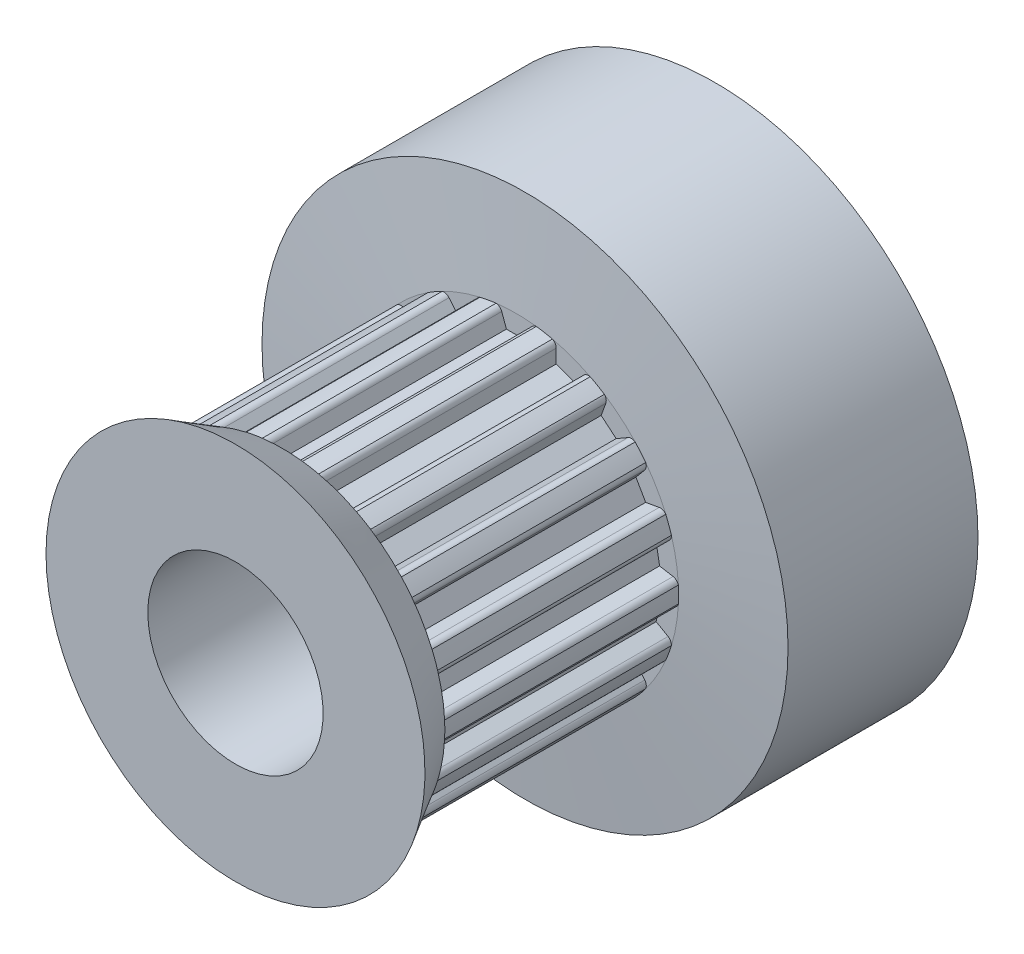
from build123d import *

# Parameters (mm, degrees)
CUT_EXTRUDE1_DEPTH      = 4
CUT_EXTRUDE1_DEPTH_BACK = 4
SKETCH9_R               = 1.5
CUT_EXTRUDE2_DEPTH      = 17.693560834
SKETCH9_3_R             = 1.5
CUT_EXTRUDE3_DEPTH      = 6


with BuildPart() as part:
    # Sketch8 → Revolve1 (revolve)
    with BuildSketch(Plane(origin=(0, 0, 0), x_dir=(0, 0, -1), z_dir=(1, 0, 0))):
        Polygon((10.801619014, -3), (10.801619014, -9), (4.301619014, -9), (4, -5.55625), (-4, -5.55625), (-5.605982468, -6.48346441), (-5.605982468, -3), align=None)
    revolve(axis=Axis((0, 0, -7.597913477), (0, 0, 1)))

    # Sketch7 → Cut-Extrude1 (cut, two sides: drawn at the far end of the back side and taken through both)
    with BuildSketch(Plane.XY.offset(-CUT_EXTRUDE1_DEPTH_BACK)):
        with BuildLine():
            Line((-1.998391183, 4.511060178), (-1.368797128, 4.740213674))
            Line((-1.368797128, 4.740213674), (-1.368797128, 5.209481486))
            ThreePointArc((-1.368797128, 5.209481486), (-1.317957962, 5.353708375), (-1.187915428, 5.434175483))
            ThreePointArc((-1.187915428, 5.434175483), (-1.902487047, 5.227040203), (-2.583024657, 4.926397251))
            ThreePointArc((-2.583024657, 4.926397251), (-2.431683036, 4.948345598), (-2.300030719, 4.870540178))
            Line((-2.300030719, 4.870540178), (-1.998391183, 4.511060178))
        make_face()
        with BuildLine():
            Line((-0.335, 4.9225), (0.335, 4.9225))
            Line((0.335, 4.9225), (0.495499044, 5.3634675))
            ThreePointArc((0.495499044, 5.3634675), (0.592600734, 5.481608424), (0.742322116, 5.512745607))
            ThreePointArc((0.742322116, 5.512745607), (0, 5.5625), (-0.742322116, 5.512745607))
            ThreePointArc((-0.742322116, 5.512745607), (-0.592600734, 5.481608424), (-0.495499044, 5.3634675))
            Line((-0.495499044, 5.3634675), (-0.335, 4.9225))
        make_face()
        with BuildLine():
            Line((1.368797128, 4.740213674), (1.998391183, 4.511060178))
            Line((1.998391183, 4.511060178), (2.300030719, 4.870540178))
            ThreePointArc((2.300030719, 4.870540178), (2.431683036, 4.948345598), (2.583024657, 4.926397251))
            ThreePointArc((2.583024657, 4.926397251), (1.902487047, 5.227040203), (1.187915428, 5.434175483))
            ThreePointArc((1.187915428, 5.434175483), (1.317957962, 5.353708375), (1.368797128, 5.209481486))
            Line((1.368797128, 5.209481486), (1.368797128, 4.740213674))
        make_face()
        with BuildLine():
            Line((2.90749712, 3.98618762), (3.420746897, 3.555519922))
            Line((3.420746897, 3.555519922), (3.827144744, 3.790153828))
            ThreePointArc((3.827144744, 3.790153828), (3.977468476, 3.818239263), (4.112176303, 3.74585268))
            ThreePointArc((4.112176303, 3.74585268), (3.575506079, 4.261122215), (2.97487284, 4.700163597))
            ThreePointArc((2.97487284, 4.700163597), (3.069551477, 4.580072082), (3.067996165, 4.427155121))
            Line((3.067996165, 4.427155121), (2.90749712, 3.98618762))
        make_face()
        with BuildLine():
            Line((4.09551005, 2.75136851), (4.43051005, 2.17113149))
            Line((4.43051005, 2.17113149), (4.89264863, 2.25261899))
            ThreePointArc((4.89264863, 2.25261899), (5.043512516, 2.227596922), (5.145338798, 2.113502994))
            ThreePointArc((5.145338798, 2.113502994), (4.817266309, 2.78125), (4.403016682, 3.399242613))
            ThreePointArc((4.403016682, 3.399242613), (4.450911782, 3.254011502), (4.397149585, 3.11084851))
            Line((4.397149585, 3.11084851), (4.09551005, 2.75136851))
        make_face()
        with BuildLine():
            Line((4.789544025, 1.184693752), (4.905888304, 0.524872557))
            Line((4.905888304, 0.524872557), (5.368026883, 0.443385057))
            ThreePointArc((5.368026883, 0.443385057), (5.501234513, 0.368273516), (5.557897497, 0.226233654))
            ThreePointArc((5.557897497, 0.226233654), (5.477993126, 0.965917988), (5.300091731, 1.688322803))
            ThreePointArc((5.300091731, 1.688322803), (5.295426438, 1.535469111), (5.195941871, 1.419327658))
            Line((5.195941871, 1.419327658), (4.789544025, 1.184693752))
        make_face()
        with BuildLine():
            Line((4.905888304, -0.524872557), (4.789544025, -1.184693752))
            Line((4.789544025, -1.184693752), (5.195941871, -1.419327658))
            ThreePointArc((5.195941871, -1.419327658), (5.295426438, -1.535469111), (5.300091731, -1.688322803))
            ThreePointArc((5.300091731, -1.688322803), (5.477993126, -0.965917988), (5.557897497, -0.226233654))
            ThreePointArc((5.557897497, -0.226233654), (5.501234513, -0.368273516), (5.368026883, -0.443385057))
            Line((5.368026883, -0.443385057), (4.905888304, -0.524872557))
        make_face()
        with BuildLine():
            Line((4.43051005, -2.17113149), (4.09551005, -2.75136851))
            Line((4.09551005, -2.75136851), (4.397149585, -3.11084851))
            ThreePointArc((4.397149585, -3.11084851), (4.450911782, -3.254011502), (4.403016682, -3.399242613))
            ThreePointArc((4.403016682, -3.399242613), (4.817266309, -2.78125), (5.145338798, -2.113502994))
            ThreePointArc((5.145338798, -2.113502994), (5.043512516, -2.227596922), (4.89264863, -2.25261899))
            Line((4.89264863, -2.25261899), (4.43051005, -2.17113149))
        make_face()
        with BuildLine():
            Line((3.420746897, -3.555519922), (2.90749712, -3.98618762))
            Line((2.90749712, -3.98618762), (3.067996165, -4.427155121))
            ThreePointArc((3.067996165, -4.427155121), (3.069551477, -4.580072082), (2.97487284, -4.700163597))
            ThreePointArc((2.97487284, -4.700163597), (3.575506079, -4.261122215), (4.112176303, -3.74585268))
            ThreePointArc((4.112176303, -3.74585268), (3.977468476, -3.818239263), (3.827144744, -3.790153828))
            Line((3.827144744, -3.790153828), (3.420746897, -3.555519922))
        make_face()
        with BuildLine():
            Line((1.998391183, -4.511060178), (1.368797128, -4.740213674))
            Line((1.368797128, -4.740213674), (1.368797128, -5.209481486))
            ThreePointArc((1.368797128, -5.209481486), (1.317957962, -5.353708375), (1.187915428, -5.434175483))
            ThreePointArc((1.187915428, -5.434175483), (1.902487047, -5.227040203), (2.583024657, -4.926397251))
            ThreePointArc((2.583024657, -4.926397251), (2.431683036, -4.948345598), (2.300030719, -4.870540178))
            Line((2.300030719, -4.870540178), (1.998391183, -4.511060178))
        make_face()
        with BuildLine():
            Line((0.335, -4.9225), (-0.335, -4.9225))
            Line((-0.335, -4.9225), (-0.495499044, -5.3634675))
            ThreePointArc((-0.495499044, -5.3634675), (-0.592600734, -5.481608424), (-0.742322116, -5.512745607))
            ThreePointArc((-0.742322116, -5.512745607), (0, -5.5625), (0.742322116, -5.512745607))
            ThreePointArc((0.742322116, -5.512745607), (0.592600734, -5.481608424), (0.495499044, -5.3634675))
            Line((0.495499044, -5.3634675), (0.335, -4.9225))
        make_face()
        with BuildLine():
            Line((-1.368797128, -4.740213674), (-1.998391183, -4.511060178))
            Line((-1.998391183, -4.511060178), (-2.300030719, -4.870540178))
            ThreePointArc((-2.300030719, -4.870540178), (-2.431683036, -4.948345598), (-2.583024657, -4.926397251))
            ThreePointArc((-2.583024657, -4.926397251), (-1.902487047, -5.227040203), (-1.187915428, -5.434175483))
            ThreePointArc((-1.187915428, -5.434175483), (-1.317957962, -5.353708375), (-1.368797128, -5.209481486))
            Line((-1.368797128, -5.209481486), (-1.368797128, -4.740213674))
        make_face()
        with BuildLine():
            Line((-2.90749712, -3.98618762), (-3.420746897, -3.555519922))
            Line((-3.420746897, -3.555519922), (-3.827144744, -3.790153828))
            ThreePointArc((-3.827144744, -3.790153828), (-3.977468476, -3.818239263), (-4.112176303, -3.74585268))
            ThreePointArc((-4.112176303, -3.74585268), (-3.575506079, -4.261122215), (-2.97487284, -4.700163597))
            ThreePointArc((-2.97487284, -4.700163597), (-3.069551477, -4.580072082), (-3.067996165, -4.427155121))
            Line((-3.067996165, -4.427155121), (-2.90749712, -3.98618762))
        make_face()
        with BuildLine():
            Line((-4.09551005, -2.75136851), (-4.43051005, -2.17113149))
            Line((-4.43051005, -2.17113149), (-4.89264863, -2.25261899))
            ThreePointArc((-4.89264863, -2.25261899), (-5.043512516, -2.227596922), (-5.145338798, -2.113502994))
            ThreePointArc((-5.145338798, -2.113502994), (-4.817266309, -2.78125), (-4.403016682, -3.399242613))
            ThreePointArc((-4.403016682, -3.399242613), (-4.450911782, -3.254011502), (-4.397149585, -3.11084851))
            Line((-4.397149585, -3.11084851), (-4.09551005, -2.75136851))
        make_face()
        with BuildLine():
            Line((-4.789544025, -1.184693752), (-4.905888304, -0.524872557))
            Line((-4.905888304, -0.524872557), (-5.368026883, -0.443385057))
            ThreePointArc((-5.368026883, -0.443385057), (-5.501234513, -0.368273516), (-5.557897497, -0.226233654))
            ThreePointArc((-5.557897497, -0.226233654), (-5.477993126, -0.965917988), (-5.300091731, -1.688322803))
            ThreePointArc((-5.300091731, -1.688322803), (-5.295426438, -1.535469111), (-5.195941871, -1.419327658))
            Line((-5.195941871, -1.419327658), (-4.789544025, -1.184693752))
        make_face()
        with BuildLine():
            Line((-4.905888304, 0.524872557), (-4.789544025, 1.184693752))
            Line((-4.789544025, 1.184693752), (-5.195941871, 1.419327658))
            ThreePointArc((-5.195941871, 1.419327658), (-5.295426438, 1.535469111), (-5.300091731, 1.688322803))
            ThreePointArc((-5.300091731, 1.688322803), (-5.477993126, 0.965917988), (-5.557897497, 0.226233654))
            ThreePointArc((-5.557897497, 0.226233654), (-5.501234513, 0.368273516), (-5.368026883, 0.443385057))
            Line((-5.368026883, 0.443385057), (-4.905888304, 0.524872557))
        make_face()
        with BuildLine():
            Line((-4.43051005, 2.17113149), (-4.09551005, 2.75136851))
            Line((-4.09551005, 2.75136851), (-4.397149585, 3.11084851))
            ThreePointArc((-4.397149585, 3.11084851), (-4.450911782, 3.254011502), (-4.403016682, 3.399242613))
            ThreePointArc((-4.403016682, 3.399242613), (-4.817266309, 2.78125), (-5.145338798, 2.113502994))
            ThreePointArc((-5.145338798, 2.113502994), (-5.043512516, 2.227596922), (-4.89264863, 2.25261899))
            Line((-4.89264863, 2.25261899), (-4.43051005, 2.17113149))
        make_face()
        with BuildLine():
            Line((-3.420746897, 3.555519922), (-2.90749712, 3.98618762))
            Line((-2.90749712, 3.98618762), (-3.067996165, 4.427155121))
            ThreePointArc((-3.067996165, 4.427155121), (-3.069551477, 4.580072082), (-2.97487284, 4.700163597))
            ThreePointArc((-2.97487284, 4.700163597), (-3.575506079, 4.261122215), (-4.112176303, 3.74585268))
            ThreePointArc((-4.112176303, 3.74585268), (-3.977468476, 3.818239263), (-3.827144744, 3.790153828))
            Line((-3.827144744, 3.790153828), (-3.420746897, 3.555519922))
        make_face()
    extrude(amount=CUT_EXTRUDE1_DEPTH + CUT_EXTRUDE1_DEPTH_BACK, mode=Mode.SUBTRACT)

    # Sketch9 → Cut-Extrude2 (cut, through all)
    with BuildSketch(Plane(origin=(0, 0, 0), x_dir=(0, 0, -1), z_dir=(1, 0, 0))):
        with Locations((7.551619014, 0)):
            Circle(SKETCH9_R)
    extrude(amount=-CUT_EXTRUDE2_DEPTH, mode=Mode.SUBTRACT)

    # Sketch9<3> → Cut-Extrude3 (cut)
    with BuildSketch(Plane(origin=(0, 0, 0), x_dir=(0, 0, -1), z_dir=(1, 0, 0))):
        Polygon((10.801619014, 3), (5.819568206, 3), (4.087517399, 0), (5.819568206, -3), (10.801619014, -3), align=None)
        with Locations((7.551619014, 0)):
            Circle(SKETCH9_3_R, mode=Mode.SUBTRACT)
    extrude(amount=-CUT_EXTRUDE3_DEPTH, mode=Mode.SUBTRACT)


solid = part.part
